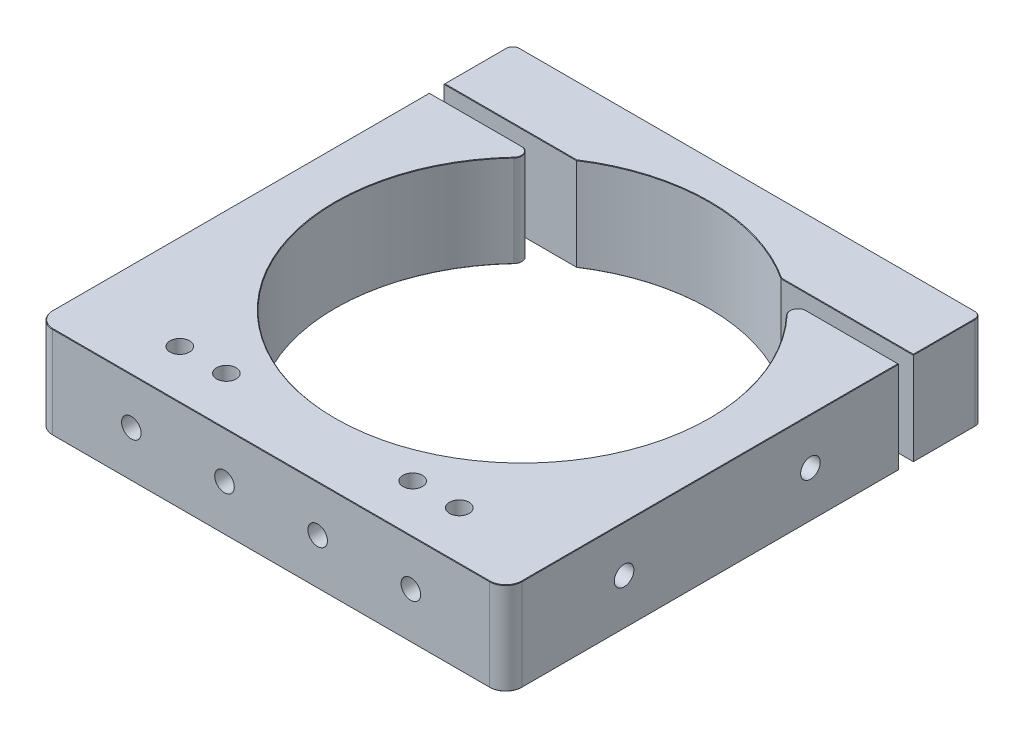
from build123d import *

# Parameters (mm, degrees)
BOSS_EXTRUDE1_DEPTH            = 9.9
BOSS_EXTRUDE2_DEPTH            = 10
FILLET1_R                      = 3.5
FILLET2_R                      = 1.75
M5X0_8_TAPPED_HOLE1_AT_2_COUNT = 2
M5X0_8_TAPPED_HOLE1_AT_2_PITCH = 20
M5X0_8_TAPPED_HOLE1_AT_3_COUNT = 2
M5X0_8_TAPPED_HOLE1_AT_3_PITCH = 40
M5X0_8_TAPPED_HOLE1_AT_4_COUNT = 2
M5X0_8_TAPPED_HOLE1_AT_4_PITCH = 60
M5X0_8_TAPPED_HOLE2_AT_2_COUNT = 2
M5X0_8_TAPPED_HOLE2_AT_2_PITCH = 40
CUT_EXTRUDE1_DEPTH             = 1
SKETCH9_R                      = 3.05
CUT_EXTRUDE2_DEPTH             = 14.75
M5X0_8_TAPPED_HOLE3_AT_2_COUNT = 2
M5X0_8_TAPPED_HOLE3_AT_2_PITCH = 83.2
SKETCH20_R                     = 5.09
CUT_EXTRUDE4_DEPTH             = 1.5
CHAMFER1_SIZE                  = 0.1
FILLET3_R                      = 1.5
CHAMFER2_SIZE                  = 0.1
SKETCH16_W                     = 2.1
SKETCH16_H                     = 19.9
M5X0_8_TAPPED_HOLE4_AT_2_COUNT = 2
M5X0_8_TAPPED_HOLE4_AT_2_PITCH = 10
M5X0_8_TAPPED_HOLE4_AT_3_COUNT = 2
M5X0_8_TAPPED_HOLE4_AT_3_PITCH = 50
M5X0_8_TAPPED_HOLE4_AT_4_COUNT = 2
M5X0_8_TAPPED_HOLE4_AT_4_PITCH = 60
CUT_EXTRUDE3_DEPTH             = 0.001


with BuildPart() as part:
    # Sketch1 → Boss-Extrude1 (new, symmetric)
    with BuildSketch(Plane(origin=(0, 0, 0), x_dir=(1, 0, 0), z_dir=(0, 1, 0))):
        with BuildLine():
            ThreePointArc((-26.1597974, 30.425), (0, -40.125), (26.1597974, 30.425))
            Line((26.1597974, 30.425), (50.375, 30.425))
            Line((50.375, 30.425), (50.375, -53.925))
            Line((50.375, -53.925), (-50.375, -53.925))
            Line((-50.375, -53.925), (-50.375, 30.425))
            Line((-50.375, 30.425), (-26.1597974, 30.425))
        make_face()
    extrude(amount=BOSS_EXTRUDE1_DEPTH, both=True)

    # Fillet1
    fillet1_edges = [part.edges().sort_by_distance(p)[0] for p in [
        (50.375, 0, 53.925),
        (-50.375, 0, 53.925),
    ]]
    fillet(fillet1_edges, radius=FILLET1_R)

    # Fillet2
    fillet2_edges = [part.edges().sort_by_distance(p)[0] for p in [
        (26.1597974, 0, -30.425),
        (-26.1597974, 0, -30.425),
    ]]
    fillet(fillet2_edges, radius=FILLET2_R)

    # Sketch4 → M5x0.8 Tapped Hole1 (revolve, cut)
    with BuildSketch(Plane(origin=(-30, 0, 53.925), x_dir=(0, -1, 0), z_dir=(1, 0, 0))):
        Polygon((0, 0), (0, 11.6618073), (2.1, 10.4), (2.1, 0), align=None)
    m5x0_8_tapped_hole1 = revolve(axis=Axis((-30, 0, 60.275), (0, 0, -1)), mode=Mode.SUBTRACT)

    # M5x0.8 Tapped Hole1 at 2: M5x0.8 Tapped Hole1 ×2
    with Locations(*[(i * M5X0_8_TAPPED_HOLE1_AT_2_PITCH, 0, 0) for i in range(1, M5X0_8_TAPPED_HOLE1_AT_2_COUNT)]):
        add(m5x0_8_tapped_hole1, mode=Mode.SUBTRACT)

    # M5x0.8 Tapped Hole1 at 3: M5x0.8 Tapped Hole1 ×2
    with Locations(*[(i * M5X0_8_TAPPED_HOLE1_AT_3_PITCH, 0, 0) for i in range(1, M5X0_8_TAPPED_HOLE1_AT_3_COUNT)]):
        add(m5x0_8_tapped_hole1, mode=Mode.SUBTRACT)

    # M5x0.8 Tapped Hole1 at 4: M5x0.8 Tapped Hole1 ×2
    with Locations(*[(i * M5X0_8_TAPPED_HOLE1_AT_4_PITCH, 0, 0) for i in range(1, M5X0_8_TAPPED_HOLE1_AT_4_COUNT)]):
        add(m5x0_8_tapped_hole1, mode=Mode.SUBTRACT)

    # Sketch7 → M5x0.8 Tapped Hole2 (revolve, cut)
    with BuildSketch(Plane(origin=(50.375, 0, 28.525), x_dir=(0, 0, -1), z_dir=(0, 1, 0))):
        Polygon((0, 0), (0, 11.6618073), (2.1, 10.4), (2.1, 0), align=None)
    m5x0_8_tapped_hole2 = revolve(axis=Axis((56.725, 0, 28.525), (-1, 0, 0)), mode=Mode.SUBTRACT)

    # M5x0.8 Tapped Hole2 at 2: M5x0.8 Tapped Hole2 ×2
    with Locations(*[(0, 0, -i * M5X0_8_TAPPED_HOLE2_AT_2_PITCH) for i in range(1, M5X0_8_TAPPED_HOLE2_AT_2_COUNT)]):
        add(m5x0_8_tapped_hole2, mode=Mode.SUBTRACT)

    # Mirror1: M5x0.8 Tapped Hole2 across plane
    add(m5x0_8_tapped_hole2.mirror(Plane(origin=(0, 0, 0), x_dir=(0, 0, 1), z_dir=(1, 0, 0))), mode=Mode.SUBTRACT)

    # Mirror1 copy 1 sketch → Mirror1 copy 1 (revolve, cut)
    with BuildSketch(Plane(origin=(-50.375, 0, -11.475), x_dir=(0, 0, -1), z_dir=(0, 1, 0))):
        Polygon((0, 0), (0, -11.6618073), (2.1, -10.4), (2.1, 0), align=None)
    revolve(axis=Axis((-56.725, 0, -11.475), (-1, 0, 0)), mode=Mode.SUBTRACT)

    # Sketch13 → M5x0.8 Tapped Hole3 (revolve, cut)
    with BuildSketch(Plane(origin=(41.6, 0, -30.425), x_dir=(0, 1, 0), z_dir=(1, 0, 0))):
        Polygon((0, 0), (0, 22.6618073), (2.1, 21.4), (2.1, 0), align=None)
    m5x0_8_tapped_hole3 = revolve(axis=Axis((41.6, 0, -36.775), (0, 0, 1)), mode=Mode.SUBTRACT)

    # M5x0.8 Tapped Hole3 at 2: M5x0.8 Tapped Hole3 ×2
    with Locations(*[(-i * M5X0_8_TAPPED_HOLE3_AT_2_PITCH, 0, 0) for i in range(1, M5X0_8_TAPPED_HOLE3_AT_2_COUNT)]):
        add(m5x0_8_tapped_hole3, mode=Mode.SUBTRACT)

    # Chamfer1
    chamfer1_edges = [part.edges().sort_by_distance(p)[0] for p in [
        (50.375, 0, -30.425),
        (-50.375, 0, -30.425),
        (0, -9.9, 53.925),
        (0, 9.9, 53.925),
        (50.375, -9.9, 10),
        (-50.375, -9.9, 10),
        (49.349873734, -9.9, 52.899873734),
        (-49.349873734, -9.9, 52.899873734),
        (-50.375, 9.9, 10),
        (50.375, 9.9, 10),
        (49.349873734, 9.9, 52.899873734),
        (40.445776443, 9.9, -30.425),
        (-49.349873734, 9.9, 52.899873734),
        (0, -9.9, 40.125),
        (0, 9.9, 40.125),
        (-28.910373122, -9.9, -29.36975648),
        (28.910373122, -9.9, -29.36975648),
        (-28.910373122, 9.9, -29.36975648),
        (28.910373122, 9.9, -29.36975648),
        (40.445776443, -9.9, -30.425),
        (-40.445776443, 9.9, -30.425),
        (-40.445776443, -9.9, -30.425),
    ]]
    chamfer(chamfer1_edges, length=CHAMFER1_SIZE)

    # Sketch16 → M5x0.8 Tapped Hole4 (revolve, cut)
    with BuildSketch(Plane(origin=(-30, 9.9, 43.525), x_dir=(0, 0, 1), z_dir=(1, 0, 0))):
        with Locations((1.05, 9.95)):
            Rectangle(SKETCH16_W, SKETCH16_H)
    m5x0_8_tapped_hole4 = revolve(axis=Axis((-30, 16.25, 43.525), (0, -1, 0)), mode=Mode.SUBTRACT)

    # M5x0.8 Tapped Hole4 at 2: M5x0.8 Tapped Hole4 ×2
    with Locations(*[(i * M5X0_8_TAPPED_HOLE4_AT_2_PITCH, 0, 0) for i in range(1, M5X0_8_TAPPED_HOLE4_AT_2_COUNT)]):
        add(m5x0_8_tapped_hole4, mode=Mode.SUBTRACT)

    # M5x0.8 Tapped Hole4 at 3: M5x0.8 Tapped Hole4 ×2
    with Locations(*[(i * M5X0_8_TAPPED_HOLE4_AT_3_PITCH, 0, 0) for i in range(1, M5X0_8_TAPPED_HOLE4_AT_3_COUNT)]):
        add(m5x0_8_tapped_hole4, mode=Mode.SUBTRACT)

    # M5x0.8 Tapped Hole4 at 4: M5x0.8 Tapped Hole4 ×2
    with Locations(*[(i * M5X0_8_TAPPED_HOLE4_AT_4_PITCH, 0, 0) for i in range(1, M5X0_8_TAPPED_HOLE4_AT_4_COUNT)]):
        add(m5x0_8_tapped_hole4, mode=Mode.SUBTRACT)


with BuildPart() as body_2:
    # Sketch1<3> → Boss-Extrude2 (new, symmetric)
    with BuildSketch(Plane(origin=(0, 0, 0), x_dir=(1, 0, 0), z_dir=(0, 1, 0))):
        with BuildLine():
            ThreePointArc((21.97123119, 33.575), (0, 40.125), (-21.97123119, 33.575))
            Line((-21.97123119, 33.575), (-50.375, 33.575))
            Line((-50.375, 33.575), (-50.375, 48.325))
            Line((-50.375, 48.325), (50.375, 48.325))
            Line((50.375, 48.325), (50.375, 33.575))
            Line((50.375, 33.575), (21.97123119, 33.575))
        make_face()
    extrude(amount=BOSS_EXTRUDE2_DEPTH, both=True)

    # Sketch8 → Cut-Extrude1 (cut)
    with BuildSketch(Plane(origin=(0, 0, -48.325), x_dir=(-1, 0, 0), z_dir=(0, 0, -1))):
        with BuildLine():
            Line((-25, -6.5), (25, -6.5))
            ThreePointArc((25, -6.5), (26.767766953, -5.767766953), (27.5, -4))
            Line((27.5, -4), (27.5, 4))
            ThreePointArc((27.5, 4), (26.767766953, 5.767766953), (25, 6.5))
            Line((25, 6.5), (-25, 6.5))
            ThreePointArc((-25, 6.5), (-26.767766953, 5.767766953), (-27.5, 4))
            Line((-27.5, 4), (-27.5, -4))
            ThreePointArc((-27.5, -4), (-26.767766953, -5.767766953), (-25, -6.5))
        make_face()
    extrude(amount=-CUT_EXTRUDE1_DEPTH, mode=Mode.SUBTRACT)

    # Sketch9 → Cut-Extrude2 (cut)
    with BuildSketch(Plane(origin=(0, 0, -48.325), x_dir=(-1, 0, 0), z_dir=(0, 0, -1))):
        with Locations((-41.6, 0)):
            Circle(SKETCH9_R)
        with Locations((41.6, 0)):
            Circle(SKETCH9_R)
    extrude(amount=-CUT_EXTRUDE2_DEPTH, mode=Mode.SUBTRACT)

    # Sketch20 → Cut-Extrude4 (cut)
    with BuildSketch(Plane(origin=(0, 0, -48.325), x_dir=(-1, 0, 0), z_dir=(0, 0, -1))):
        with Locations((-41.6, 0)):
            Circle(SKETCH20_R)
        with Locations((41.6, 0)):
            Circle(SKETCH20_R)
    extrude(amount=-CUT_EXTRUDE4_DEPTH, mode=Mode.SUBTRACT)

    # Fillet3
    fillet3_edges = [body_2.edges().sort_by_distance(p)[0] for p in [
        (-50.375, 0, -48.325),
        (50.375, 0, -48.325),
    ]]
    fillet(fillet3_edges, radius=FILLET3_R)

    # Chamfer2
    chamfer2_edges = [body_2.edges().sort_by_distance(p)[0] for p in [
        (50.375, 10, -40.2),
        (-50.375, 10, -40.2),
        (-36.173115595, 10, -33.575),
        (0, 10, -40.125),
        (0, -10, -48.325),
        (0, 10, -48.325),
        (-36.173115595, -10, -33.575),
        (-49.935660172, -10, -47.885660172),
        (49.935660172, -10, -47.885660172),
        (-49.935660172, 10, -47.885660172),
        (49.935660172, 10, -47.885660172),
        (-50.375, -10, -40.2),
        (50.375, -10, -40.2),
        (36.173115595, 10, -33.575),
        (36.173115595, -10, -33.575),
        (0, -10, -40.125),
    ]]
    chamfer(chamfer2_edges, length=CHAMFER2_SIZE)

    # Sketch17 → Cut-Extrude3 (cut)
    # profile 1 of 5: a face of its own
    with BuildSketch(Plane(origin=(0, 0, -47.325), x_dir=(-1, 0, 0), z_dir=(0, 0, -1))):
        with BuildLine():
            add(Edge.make_bspline(
                [(-14.995192308, 2.926282051), (-14.905475878, 2.83030885), (-14.726669214, 2.639032313), (-14.496639815, 2.32089689), (-14.297503803, 1.982729094), (-14.135159407, 1.622747777), (-14.003497398, 1.245727587), (-13.913967781, 0.850519345), (-13.854928948, 0.44035452), (-13.849107978, 0.16100179), (-13.846153846, 0.019230769)],
                knots=[0, 0, 0, 0, 0.981961129, 1.957068436, 2.929584897, 3.913130261, 4.906417375, 5.911594059, 6.94013765, 8, 8, 8, 8], degree=3))
            add(Edge.make_bspline(
                [(-13.846153846, 0.019230769), (-13.849701403, -0.125203306), (-13.856694317, -0.409910481), (-13.91644456, -0.827862903), (-14.010484082, -1.229555818), (-14.143456219, -1.614727204), (-14.318487649, -1.981657343), (-14.529595457, -2.332476366), (-14.777250204, -2.668003448), (-15.063006371, -2.980246153), (-15.374031761, -3.266728052), (-15.705102829, -3.519229111), (-16.055293689, -3.729471708), (-16.420362325, -3.903986689), (-16.802799213, -4.039467976), (-17.202378844, -4.13519033), (-17.61894679, -4.194492664), (-17.902579745, -4.20154856), (-18.046474359, -4.205128205)],
                knots=[0, 0, 0, 0, 1.044514704, 2.058938173, 3.047908479, 4.025699844, 5.000722405, 5.983655766, 6.983874203, 8.012582426, 9.041043788, 10.039707976, 11.019330699, 11.990861941, 12.962639136, 13.948750856, 14.959346228, 16, 16, 16, 16], degree=3))
            add(Edge.make_bspline(
                [(-18.046474359, -4.205128205), (-18.156620339, -4.203173692), (-18.374818327, -4.199301823), (-18.697698307, -4.162272874), (-19.013472714, -4.105420374), (-19.321666832, -4.022562781), (-19.623495221, -3.919533577), (-19.916075949, -3.789255478), (-20.203212481, -3.639579441), (-20.385511917, -3.521275894), (-20.477564103, -3.461538462)],
                knots=[0, 0, 0, 0, 1.023812046, 2.028160523, 3.017996657, 4.004749707, 4.99280207, 5.980292441, 6.980147716, 8, 8, 8, 8], degree=3))
            Line((-20.477564103, -3.461538462), (-21.314102564, -4.434294872))
            Line((-21.314102564, -4.434294872), (-21.897435897, -4.051282051))
            Line((-21.897435897, -4.051282051), (-21.012820513, -3.022435897))
            add(Edge.make_bspline(
                [(-21.012820513, -3.022435897), (-21.112344754, -2.92083419), (-21.308477025, -2.720607861), (-21.559885901, -2.388160837), (-21.776525865, -2.04204346), (-21.952374489, -1.67650305), (-22.089347009, -1.29412555), (-22.184458351, -0.893093976), (-22.246310585, -0.475749842), (-22.253011645, -0.190928604), (-22.256410256, -0.046474359)],
                knots=[0, 0, 0, 0, 1.028005719, 2.025889293, 3.00822111, 3.977890377, 4.954557743, 5.94062254, 6.955534997, 8, 8, 8, 8], degree=3))
            add(Edge.make_bspline(
                [(-22.256410256, -0.046474359), (-22.255183627, 0.049219464), (-22.252745787, 0.23940435), (-22.223628026, 0.521321807), (-22.181152612, 0.798192215), (-22.11992219, 1.069607392), (-22.041224021, 1.336188956), (-21.945172487, 1.597572502), (-21.830739484, 1.853302547), (-21.699678384, 2.101909435), (-21.554660713, 2.34243175), (-21.394128198, 2.569246815), (-21.222283171, 2.784297435), (-21.035731847, 2.983852514), (-20.838797551, 3.172409356), (-20.628189334, 3.345802827), (-20.404486628, 3.504754286), (-20.169273508, 3.649881762), (-19.925542024, 3.781844973), (-19.672865424, 3.892995511), (-19.415573463, 3.990755245), (-19.151769946, 4.068218945), (-18.882165332, 4.130319214), (-18.606761242, 4.172145145), (-18.325421505, 4.201556069), (-18.13576148, 4.203930255), (-18.040064103, 4.205128205)],
                knots=[0, 0, 0, 0, 1.032463199, 2.05194952, 3.055794488, 4.054526573, 5.052459485, 6.053917263, 7.057911242, 8.074049756, 9.085614184, 10.086988971, 11.071186015, 12.05441994, 13.033197727, 14.012094382, 14.996021172, 15.992837502, 16.993697593, 17.984811524, 18.970055101, 19.962459534, 20.949944353, 21.953789321, 22.967536801, 24, 24, 24, 24], degree=3))
            add(Edge.make_bspline(
                [(-18.040064103, 4.205128205), (-17.92458896, 4.202551367), (-17.696252356, 4.197456016), (-17.357389854, 4.160185755), (-17.027499922, 4.095820821), (-16.705270232, 4.006729619), (-16.390125394, 3.895902395), (-16.085181903, 3.753781895), (-15.785553422, 3.592303116), (-15.596709179, 3.463770603), (-15.501602564, 3.399038462)],
                knots=[0, 0, 0, 0, 1.023710526, 2.024250235, 3.018120468, 4.000515576, 4.986227305, 5.97594737, 6.980637206, 8, 8, 8, 8], degree=3))
            Line((-15.501602564, 3.399038462), (-14.788461538, 4.229166667))
            Line((-14.788461538, 4.229166667), (-14.205128205, 3.846153846))
            Line((-14.205128205, 3.846153846), (-14.995192308, 2.926282051))
        make_face()
        with BuildLine():
            Line((-20.516025641, -2.440705128), (-16.016025641, 2.798076923))
            add(Edge.make_bspline(
                [(-16.016025641, 2.798076923), (-16.087337756, 2.845357658), (-16.229593634, 2.939674907), (-16.45705753, 3.056988223), (-16.692284361, 3.159280046), (-16.937253549, 3.242253186), (-17.191239582, 3.306632111), (-17.454410109, 3.351048791), (-17.72642985, 3.378902796), (-17.91125733, 3.382695639), (-18.004807692, 3.384615385)],
                knots=[0, 0, 0, 0, 0.974350033, 1.943667194, 2.911607211, 3.89526798, 4.887386831, 5.894131756, 6.934115557, 8, 8, 8, 8], degree=3))
            add(Edge.make_bspline(
                [(-18.004807692, 3.384615385), (-18.081792618, 3.38366781), (-18.23556374, 3.381775108), (-18.463965727, 3.357706656), (-18.689912814, 3.322923274), (-18.912179698, 3.273431408), (-19.131468092, 3.208602125), (-19.347800628, 3.130206276), (-19.56132401, 3.036978802), (-19.769817618, 2.930076029), (-19.971810462, 2.811718192), (-20.163825479, 2.68265201), (-20.343175255, 2.542230497), (-20.513682023, 2.394911901), (-20.669227625, 2.23402037), (-20.816347191, 2.066158697), (-20.949543038, 1.886408166), (-21.072629847, 1.699159027), (-21.181283888, 1.502610076), (-21.278579322, 1.301103325), (-21.357614347, 1.092576526), (-21.424621207, 0.879303601), (-21.475140651, 0.660077063), (-21.512755773, 0.434850354), (-21.533030039, 0.203898044), (-21.536640725, 0.048111859), (-21.538461538, -0.030448718)],
                knots=[0, 0, 0, 0, 1.013512141, 2.024408004, 3.021474407, 4.023443592, 5.020807819, 6.031238402, 7.052074388, 8.087283119, 9.115342633, 10.133945689, 11.131731682, 12.113917714, 13.098997308, 14.076561144, 15.05169146, 16.043007304, 17.025671991, 18.007530388, 18.98747119, 19.959932871, 20.949749597, 21.947932383, 22.965173865, 24, 24, 24, 24], degree=3))
            add(Edge.make_bspline(
                [(-21.538461538, -0.030448718), (-21.535468446, -0.143338726), (-21.529553714, -0.366423776), (-21.479844721, -0.695056816), (-21.399777874, -1.013031871), (-21.286270477, -1.320165788), (-21.143582623, -1.61901108), (-20.96550084, -1.905368934), (-20.759047835, -2.184155761), (-20.598012389, -2.35415481), (-20.516025641, -2.440705128)],
                knots=[0, 0, 0, 0, 1.007398495, 1.990747874, 2.960038447, 3.930173371, 4.909234549, 5.911199966, 6.936545179, 8, 8, 8, 8], degree=3))
        make_face(mode=Mode.SUBTRACT)
        with BuildLine():
            Line((-15.504807692, 2.330128205), (-19.975961538, -2.876602564))
            add(Edge.make_bspline(
                [(-19.975961538, -2.876602564), (-19.908621056, -2.917006593), (-19.774282259, -2.99760935), (-19.563485891, -3.103013696), (-19.343273585, -3.187994844), (-19.117000123, -3.261841667), (-18.88177811, -3.315100691), (-18.640009382, -3.355488403), (-18.389935232, -3.380204112), (-18.220675419, -3.383128488), (-18.134615385, -3.384615385)],
                knots=[0, 0, 0, 0, 0.973214489, 1.9414839, 2.916498556, 3.896468988, 4.889018759, 5.902417826, 6.933485811, 8, 8, 8, 8], degree=3))
            add(Edge.make_bspline(
                [(-18.134615385, -3.384615385), (-18.053905579, -3.383531391), (-17.893812737, -3.381381225), (-17.655664699, -3.359621778), (-17.422184148, -3.325072926), (-17.193411224, -3.274416306), (-16.969625546, -3.212361317), (-16.74966655, -3.137047755), (-16.535721061, -3.044933874), (-16.325945939, -2.941642199), (-16.125066537, -2.824810412), (-15.933912192, -2.698130981), (-15.753534996, -2.56171583), (-15.585334466, -2.414459047), (-15.429031034, -2.255951203), (-15.283153846, -2.088471393), (-15.150039222, -1.909581363), (-15.028256507, -1.722391379), (-14.91920332, -1.527125052), (-14.824835266, -1.325062832), (-14.744100869, -1.117459799), (-14.678583643, -0.904219119), (-14.627304186, -0.685765233), (-14.589963478, -0.462613855), (-14.569452187, -0.23382526), (-14.565900093, -0.079631819), (-14.564102564, -0.001602564)],
                knots=[0, 0, 0, 0, 1.059116737, 2.100822918, 3.13606712, 4.155158008, 5.17415241, 6.183061831, 7.204080535, 8.229447547, 9.250466251, 10.2519662, 11.237807278, 12.216641935, 13.183449152, 14.157677384, 15.129480399, 16.107712171, 17.087023848, 18.062538024, 19.03259417, 20.008435864, 20.988048699, 21.975907368, 22.975712335, 24, 24, 24, 24], degree=3))
            add(Edge.make_bspline(
                [(-14.564102564, -0.001602564), (-14.566668647, 0.105936891), (-14.571759855, 0.3192993), (-14.618856333, 0.634713237), (-14.691657375, 0.941364129), (-14.795651092, 1.238397586), (-14.927376898, 1.526972619), (-15.090513799, 1.805778134), (-15.281023018, 2.077394189), (-15.429393776, 2.244958557), (-15.504807692, 2.330128205)],
                knots=[0, 0, 0, 0, 1.001482496, 1.986979746, 2.964867839, 3.934550693, 4.914564687, 5.915985334, 6.940736631, 8, 8, 8, 8], degree=3))
        make_face(mode=Mode.SUBTRACT)
    # profile 2 of 5: a face of its own
    with BuildSketch(Plane(origin=(0, 0, -47.325), x_dir=(-1, 0, 0), z_dir=(0, 0, -1))):
        with BuildLine():
            add(Edge.make_bspline(
                [(-5.956730769, 0.456730769), (-5.891248376, 0.42258687), (-5.763535839, 0.355994863), (-5.581645078, 0.248770114), (-5.415416504, 0.135762195), (-5.260238077, 0.022308802), (-5.118836132, -0.095934973), (-4.99279176, -0.21943933), (-4.878991486, -0.345121491), (-4.779730265, -0.475109697), (-4.69242321, -0.609058609), (-4.616966901, -0.747319805), (-4.552470437, -0.889590282), (-4.501355149, -1.037423036), (-4.459248196, -1.188646491), (-4.430275385, -1.345213307), (-4.414693858, -1.5060918), (-4.411747999, -1.614819347), (-4.41025641, -1.669871795)],
                knots=[0, 0, 0, 0, 1.272397273, 2.481599622, 3.635517121, 4.734568067, 5.792894095, 6.808321871, 7.773003508, 8.711915296, 9.623354172, 10.525449501, 11.423591555, 12.311487226, 13.218079475, 14.126165749, 15.051214107, 16, 16, 16, 16], degree=3))
            add(Edge.make_bspline(
                [(-4.41025641, -1.669871795), (-4.412019657, -1.746895184), (-4.415509785, -1.899353371), (-4.445909748, -2.124373054), (-4.491425127, -2.34291427), (-4.557892584, -2.554929106), (-4.64409462, -2.759247674), (-4.750327388, -2.95604487), (-4.870581571, -3.148546148), (-4.967158118, -3.266990495), (-5.016025641, -3.326923077)],
                knots=[0, 0, 0, 0, 1.025265484, 2.029385089, 3.018602448, 3.995076438, 4.983346944, 5.966715145, 6.97116228, 8, 8, 8, 8], degree=3))
            add(Edge.make_bspline(
                [(-5.016025641, -3.326923077), (-5.079651868, -3.396851704), (-5.206118075, -3.53584483), (-5.422764767, -3.716303824), (-5.660529073, -3.867959582), (-5.918490976, -3.991552484), (-6.195960922, -4.087748733), (-6.49287979, -4.156874488), (-6.809826425, -4.196468612), (-7.027667502, -4.202192017), (-7.139423077, -4.205128205)],
                knots=[0, 0, 0, 0, 0.954267603, 1.896743057, 2.838368354, 3.796610408, 4.779680527, 5.799409237, 6.871065594, 8, 8, 8, 8], degree=3))
            add(Edge.make_bspline(
                [(-7.139423077, -4.205128205), (-7.246882251, -4.20249397), (-7.455986889, -4.197368015), (-7.760347752, -4.162637886), (-8.044057625, -4.101774191), (-8.308766124, -4.018472227), (-8.552877423, -3.910105991), (-8.77569594, -3.775229628), (-8.980436448, -3.619272046), (-9.160885531, -3.437754153), (-9.321087688, -3.243336159), (-9.461814667, -3.042761051), (-9.578783989, -2.836010519), (-9.67781735, -2.626167394), (-9.753629973, -2.41029047), (-9.806137882, -2.18949044), (-9.839484886, -1.964152971), (-9.843921766, -1.812080621), (-9.846153846, -1.735576923)],
                knots=[0, 0, 0, 0, 1.256902934, 2.445805442, 3.576955095, 4.645999104, 5.686449165, 6.692658513, 7.68621702, 8.689161843, 9.678783111, 10.630372946, 11.551080876, 12.453998257, 13.34127905, 14.221779781, 15.105423033, 16, 16, 16, 16], degree=3))
            add(Edge.make_bspline(
                [(-9.846153846, -1.735576923), (-9.844832975, -1.679441627), (-9.842222468, -1.568498468), (-9.824154244, -1.404591432), (-9.795106332, -1.24505741), (-9.755656145, -1.089307139), (-9.702190942, -0.938474516), (-9.637637494, -0.791844862), (-9.56236446, -0.649252636), (-9.475321797, -0.50991805), (-9.374060028, -0.375793451), (-9.259400257, -0.244602606), (-9.129050843, -0.118381195), (-8.984461908, 0.004412919), (-8.827285818, 0.125958002), (-8.653440034, 0.239685381), (-8.467533136, 0.353646444), (-8.335406495, 0.421779759), (-8.267628205, 0.456730769)],
                knots=[0, 0, 0, 0, 0.941657376, 1.861047343, 2.762797495, 3.66048619, 4.553285746, 5.444104102, 6.34607688, 7.256116206, 8.197091036, 9.162375105, 10.176350973, 11.237807142, 12.343728897, 13.50695164, 14.721116704, 16, 16, 16, 16], degree=3))
            add(Edge.make_bspline(
                [(-8.267628205, 0.456730769), (-8.36040849, 0.507324526), (-8.540057091, 0.6052882), (-8.777930099, 0.7852809), (-8.982251524, 0.980224477), (-9.147405165, 1.194235436), (-9.277398829, 1.420628292), (-9.366584211, 1.657986583), (-9.426919031, 1.901909128), (-9.432895779, 2.068551863), (-9.435897436, 2.15224359)],
                knots=[0, 0, 0, 0, 1.166880483, 2.259407225, 3.286803203, 4.280235371, 5.237608625, 6.161067461, 7.076446754, 8, 8, 8, 8], degree=3))
            add(Edge.make_bspline(
                [(-9.435897436, 2.15224359), (-9.432159324, 2.237495152), (-9.424645066, 2.408865659), (-9.363883191, 2.663965369), (-9.264865896, 2.914517518), (-9.130189331, 3.159307719), (-8.962447123, 3.390051067), (-8.761197875, 3.597001801), (-8.531247482, 3.778285189), (-8.273743786, 3.930459299), (-7.99663239, 4.054307662), (-7.704253593, 4.139744057), (-7.401701609, 4.195598038), (-7.195763964, 4.20192182), (-7.091346154, 4.205128205)],
                knots=[0, 0, 0, 0, 0.888701115, 1.786444228, 2.72001202, 3.692817113, 4.693886446, 5.687152267, 6.695133018, 7.739871481, 8.800368666, 9.853104506, 10.91144658, 12, 12, 12, 12], degree=3))
            add(Edge.make_bspline(
                [(-7.091346154, 4.205128205), (-6.989623148, 4.201822278), (-6.78903697, 4.195303366), (-6.494192106, 4.140933359), (-6.212078101, 4.050123029), (-5.943667818, 3.926929375), (-5.693766406, 3.775187796), (-5.472961128, 3.59141437), (-5.277915226, 3.38537654), (-5.116579468, 3.154703161), (-4.983635721, 2.910853575), (-4.891062233, 2.655716384), (-4.831743435, 2.39480425), (-4.82426146, 2.218260241), (-4.820512821, 2.129807692)],
                knots=[0, 0, 0, 0, 1.072916533, 2.115669174, 3.151510826, 4.193348718, 5.225979165, 6.227137561, 7.216255879, 8.211077061, 9.189680878, 10.138522389, 11.067357538, 12, 12, 12, 12], degree=3))
            add(Edge.make_bspline(
                [(-4.820512821, 2.129807692), (-4.823791816, 2.043003889), (-4.830231577, 1.872526154), (-4.884402868, 1.624008392), (-4.975633299, 1.391272304), (-5.100191386, 1.171676984), (-5.262535357, 0.96920499), (-5.460498176, 0.78128163), (-5.692501554, 0.606363165), (-5.866812151, 0.507651475), (-5.956730769, 0.456730769)],
                knots=[0, 0, 0, 0, 0.975232327, 1.915300861, 2.843280834, 3.77672583, 4.742871857, 5.749627742, 6.839139064, 8, 8, 8, 8], degree=3))
        make_face()
        with BuildLine():
            add(Edge.make_bspline(
                [(-7.131410256, 3.384615385), (-7.187526384, 3.383126378), (-7.297314067, 3.380213229), (-7.458293886, 3.364993487), (-7.611373583, 3.335386135), (-7.758152556, 3.295983365), (-7.896618413, 3.242753678), (-8.02865168, 3.180136514), (-8.152005257, 3.104008364), (-8.268168235, 3.018611341), (-8.372741434, 2.924684698), (-8.465551838, 2.826824769), (-8.54264467, 2.723109588), (-8.608110063, 2.616119051), (-8.655610675, 2.502677734), (-8.691186226, 2.386263616), (-8.715235121, 2.265405596), (-8.717037156, 2.182807857), (-8.717948718, 2.141025641)],
                knots=[0, 0, 0, 0, 1.203892937, 2.355340988, 3.463153438, 4.544400666, 5.610487187, 6.640501085, 7.674077295, 8.714426146, 9.728707835, 10.68524104, 11.601827946, 12.495867327, 13.368432065, 14.231010473, 15.105153427, 16, 16, 16, 16], degree=3))
            add(Edge.make_bspline(
                [(-8.717948718, 2.141025641), (-8.716377594, 2.099241619), (-8.713272826, 2.01667039), (-8.689261105, 1.894736982), (-8.653474008, 1.774916098), (-8.597129639, 1.660056872), (-8.529549392, 1.546174909), (-8.446140304, 1.436116426), (-8.346736811, 1.329498404), (-8.234674091, 1.227227681), (-8.112590576, 1.13145908), (-7.98325562, 1.048320379), (-7.848292439, 0.978756698), (-7.70908771, 0.920860916), (-7.564222687, 0.875855345), (-7.414585033, 0.84392701), (-7.2601496, 0.824082446), (-7.155508272, 0.821712111), (-7.102564103, 0.820512821)],
                knots=[0, 0, 0, 0, 0.873023192, 1.725219244, 2.590779336, 3.480155217, 4.391973325, 5.357036234, 6.360879153, 7.436073238, 8.526419356, 9.601555421, 10.645666583, 11.697338044, 12.750135903, 13.812665442, 14.89329948, 16, 16, 16, 16], degree=3))
            add(Edge.make_bspline(
                [(-7.102564103, 0.820512821), (-7.034563865, 0.822507945), (-6.899235025, 0.82647849), (-6.69973941, 0.863395458), (-6.505767651, 0.921466127), (-6.319393013, 1.000917479), (-6.145439675, 1.100638301), (-5.990376662, 1.220028057), (-5.855526621, 1.356329993), (-5.742290941, 1.507422189), (-5.654497006, 1.66822582), (-5.586150017, 1.829597917), (-5.546238667, 1.99326016), (-5.5410328, 2.102898934), (-5.538461538, 2.157051282)],
                knots=[0, 0, 0, 0, 1.076279235, 2.141928126, 3.20205304, 4.278698113, 5.344010996, 6.36967002, 7.368914609, 8.37248503, 9.349703398, 10.264243087, 11.142681841, 12, 12, 12, 12], degree=3))
            add(Edge.make_bspline(
                [(-5.538461538, 2.157051282), (-5.539677304, 2.195058221), (-5.542090425, 2.270496548), (-5.561976268, 2.381898526), (-5.594835314, 2.490766145), (-5.639322355, 2.597998764), (-5.697859028, 2.702091866), (-5.767262885, 2.804681782), (-5.851570317, 2.90346067), (-5.946190736, 3.000730495), (-6.053494528, 3.090751121), (-6.173274899, 3.169916173), (-6.304917757, 3.237144416), (-6.448426214, 3.291747284), (-6.603271754, 3.332758369), (-6.768741182, 3.363470021), (-6.946214203, 3.38077999), (-7.068339349, 3.383309192), (-7.131410256, 3.384615385)],
                knots=[0, 0, 0, 0, 0.814439003, 1.616544685, 2.417341072, 3.248991801, 4.09997495, 4.973547432, 5.9003056, 6.880240646, 7.880314356, 8.896779544, 9.951930927, 11.043077905, 12.18215768, 13.381699519, 14.647792085, 16, 16, 16, 16], degree=3))
        make_face(mode=Mode.SUBTRACT)
        with BuildLine():
            add(Edge.make_bspline(
                [(-7.084935897, 0), (-7.15608055, -0.001265466), (-7.295648999, -0.003748001), (-7.500121978, -0.031381145), (-7.696357785, -0.069848329), (-7.883694782, -0.128204532), (-8.062053861, -0.204082224), (-8.232400564, -0.295361172), (-8.393431717, -0.403259328), (-8.542923663, -0.526405878), (-8.67943413, -0.659113201), (-8.799201673, -0.799598081), (-8.900910291, -0.945249585), (-8.982814865, -1.097917538), (-9.050041681, -1.25436922), (-9.094187686, -1.418500866), (-9.122488741, -1.587157125), (-9.126289042, -1.701808778), (-9.128205128, -1.759615385)],
                knots=[0, 0, 0, 0, 1.140299081, 2.23698856, 3.303958914, 4.344563908, 5.37730929, 6.408454204, 7.439741482, 8.480804886, 9.510774543, 10.48932336, 11.43758569, 12.353841022, 13.263987381, 14.161954604, 15.073269652, 16, 16, 16, 16], degree=3))
            add(Edge.make_bspline(
                [(-9.128205128, -1.759615385), (-9.125089108, -1.831457456), (-9.118906997, -1.973990446), (-9.069863251, -2.184648895), (-8.991153456, -2.388582735), (-8.881381534, -2.584130055), (-8.745455654, -2.766873155), (-8.578309441, -2.926161785), (-8.390330383, -3.067696593), (-8.175158146, -3.182166384), (-7.940121652, -3.273583196), (-7.685283414, -3.336568253), (-7.414300743, -3.378262996), (-7.227193103, -3.382464553), (-7.131410256, -3.384615385)],
                knots=[0, 0, 0, 0, 0.898778495, 1.783155532, 2.693654817, 3.627872908, 4.583023416, 5.533784346, 6.509005473, 7.520592997, 8.575161974, 9.658835044, 10.801527049, 12, 12, 12, 12], degree=3))
            add(Edge.make_bspline(
                [(-7.131410256, -3.384615385), (-7.056552273, -3.383178108), (-6.910704915, -3.380377833), (-6.697937032, -3.355659446), (-6.497149492, -3.316460304), (-6.308731667, -3.259446485), (-6.130574319, -3.189846538), (-5.965698081, -3.100310352), (-5.809861448, -2.998476471), (-5.670743453, -2.877657827), (-5.544038976, -2.748561839), (-5.433562879, -2.611898884), (-5.337659905, -2.471383153), (-5.262389149, -2.323839188), (-5.202214854, -2.172097669), (-5.158961015, -2.014759357), (-5.132272523, -1.851341682), (-5.129573333, -1.740486662), (-5.128205128, -1.684294872)],
                knots=[0, 0, 0, 0, 1.224942928, 2.386581632, 3.501229538, 4.569074225, 5.605009692, 6.626002462, 7.634866581, 8.645888296, 9.63523824, 10.59253846, 11.518950513, 12.414518923, 13.29783783, 14.186679152, 15.080837789, 16, 16, 16, 16], degree=3))
            add(Edge.make_bspline(
                [(-5.128205128, -1.684294872), (-5.130275639, -1.629718093), (-5.134358325, -1.52210222), (-5.160270762, -1.362635873), (-5.205792767, -1.208572298), (-5.268255389, -1.058057999), (-5.351411875, -0.914142683), (-5.449343006, -0.773077148), (-5.567500992, -0.638776703), (-5.701015497, -0.510198198), (-5.846521693, -0.391305086), (-6.001189453, -0.286129226), (-6.163828223, -0.19755296), (-6.334093848, -0.125515257), (-6.511608262, -0.068858183), (-6.696240898, -0.029278766), (-6.888207926, -0.004365388), (-7.01861906, -0.001471569), (-7.084935897, 0)],
                knots=[0, 0, 0, 0, 0.917430815, 1.809013306, 2.70690318, 3.612392954, 4.541220862, 5.495268465, 6.494511384, 7.542276156, 8.608045339, 9.649016899, 10.681629292, 11.715607085, 12.752076957, 13.808767841, 14.885711793, 16, 16, 16, 16], degree=3))
        make_face(mode=Mode.SUBTRACT)
    # profile 3 of 5: a face of its own
    with BuildSketch(Plane(origin=(0, 0, -47.325), x_dir=(-1, 0, 0), z_dir=(0, 0, -1))):
        with BuildLine():
            add(Edge.make_bspline(
                [(-3.692307692, -0.003205128), (-3.691557937, 0.125017472), (-3.690101525, 0.374091722), (-3.67389942, 0.737028047), (-3.646984352, 1.077508707), (-3.610098928, 1.395550001), (-3.565212116, 1.691234034), (-3.505291004, 1.963770622), (-3.437147455, 2.214421151), (-3.358170436, 2.444002977), (-3.26905549, 2.655609155), (-3.172062894, 2.853152472), (-3.063343364, 3.036334032), (-2.94911042, 3.208077553), (-2.824739971, 3.365571712), (-2.693771307, 3.511040655), (-2.551092732, 3.64112237), (-2.401554428, 3.759628205), (-2.243802509, 3.863512711), (-2.082333558, 3.955016114), (-1.916036173, 4.033187239), (-1.744456327, 4.094651092), (-1.569136194, 4.145418742), (-1.389462899, 4.180136337), (-1.205139781, 4.201980699), (-1.080725073, 4.204069082), (-1.017628205, 4.205128205)],
                knots=[0, 0, 0, 0, 1.646270934, 3.197905019, 4.663502075, 6.030701355, 7.308322542, 8.50163776, 9.611534131, 10.641858119, 11.616356847, 12.558055219, 13.465016945, 14.349605745, 15.204443733, 16.039544428, 16.859896111, 17.680448484, 18.487036065, 19.28249412, 20.06191084, 20.843045899, 21.620316918, 22.403196591, 23.190181807, 24, 24, 24, 24], degree=3))
            add(Edge.make_bspline(
                [(-1.017628205, 4.205128205), (-0.954004254, 4.204013199), (-0.827476234, 4.201795803), (-0.640412519, 4.180483934), (-0.457670389, 4.145121367), (-0.28002893, 4.095016282), (-0.106028961, 4.032854736), (0.062968543, 3.954941325), (0.228013301, 3.864246771), (0.386482529, 3.757677909), (0.540115936, 3.638861277), (0.685139851, 3.504546606), (0.821567476, 3.356090105), (0.951111031, 3.19508013), (1.070095253, 3.018428508), (1.183405956, 2.829207685), (1.284827752, 2.624108566), (1.38250701, 2.40655321), (1.466820122, 2.17052199), (1.542857254, 1.917345395), (1.604294897, 1.644032968), (1.655470376, 1.352018693), (1.695115853, 1.04023016), (1.723990463, 0.709335724), (1.739243229, 0.359117689), (1.742115689, 0.119671176), (1.743589744, -0.003205128)],
                knots=[0, 0, 0, 0, 0.810914788, 1.612654377, 2.396697861, 3.181598691, 3.963628158, 4.749916497, 5.551656086, 6.361998678, 7.18212741, 8.025565596, 8.878627764, 9.750805457, 10.657531673, 11.591944965, 12.560506719, 13.57287815, 14.630710178, 15.753379473, 16.941251878, 18.199788006, 19.531962791, 20.947069417, 22.433333509, 24, 24, 24, 24], degree=3))
            add(Edge.make_bspline(
                [(1.743589744, -0.003205128), (1.742100407, -0.125545489), (1.739198497, -0.363920693), (1.724161453, -0.712562923), (1.694541724, -1.041701307), (1.657490323, -1.352125222), (1.606173836, -1.642542636), (1.543076313, -1.913958518), (1.473018432, -2.167544968), (1.386538903, -2.401224537), (1.291885851, -2.618257047), (1.188902545, -2.820924814), (1.078571514, -3.011019198), (0.958368668, -3.187018619), (0.830246581, -3.350169835), (0.691463064, -3.497592973), (0.545930298, -3.632840223), (0.391844776, -3.7531868), (0.230904087, -3.858523496), (0.066426197, -3.952726583), (-0.10450725, -4.028687029), (-0.278022571, -4.09390998), (-0.456601694, -4.143739584), (-0.640022015, -4.178194111), (-0.827350554, -4.202358336), (-0.953982703, -4.204201718), (-1.017628205, -4.205128205)],
                knots=[0, 0, 0, 0, 1.561518951, 3.042555995, 4.452378317, 5.7783523, 7.031515105, 8.214008947, 9.334062868, 10.386615937, 11.391082383, 12.354592575, 13.286541444, 14.194233754, 15.072674879, 15.931287219, 16.775624067, 17.606195743, 18.42308326, 19.229000347, 20.022332153, 20.807536673, 21.593273796, 22.3848459, 23.188221202, 24, 24, 24, 24], degree=3))
            add(Edge.make_bspline(
                [(-1.017628205, -4.205128205), (-1.080723323, -4.20406225), (-1.205134579, -4.201960394), (-1.38948298, -4.180214722), (-1.56841428, -4.145253572), (-1.742811432, -4.096301334), (-1.913569181, -4.036381708), (-2.078360693, -3.958316145), (-2.239018256, -3.868409702), (-2.395113241, -3.766020167), (-2.543712466, -3.648713463), (-2.685652135, -3.518966518), (-2.817366465, -3.373541577), (-2.939958683, -3.214734896), (-3.056470885, -3.044007485), (-3.163646595, -2.859028347), (-3.262779976, -2.660530951), (-3.353393669, -2.44723287), (-3.433733471, -2.216021606), (-3.504699661, -1.964252055), (-3.560732021, -1.68970203), (-3.608693062, -1.394576619), (-3.647377366, -1.077607635), (-3.673787253, -0.738623), (-3.690110258, -0.377833951), (-3.691561848, -0.130360181), (-3.692307692, -0.003205128)],
                knots=[0, 0, 0, 0, 0.810891512, 1.598919785, 2.382837074, 3.152667961, 3.926044502, 4.706494248, 5.493654104, 6.291793342, 7.103789334, 7.925228297, 8.761435821, 9.622817696, 10.50288917, 11.416980706, 12.369136599, 13.353924996, 14.394355917, 15.514179734, 16.714354668, 17.994756427, 19.357759367, 20.818452758, 22.365282078, 24, 24, 24, 24], degree=3))
        make_face()
        with BuildLine():
            add(Edge.make_bspline(
                [(-2.974358974, 0), (-2.974085952, -0.106854169), (-2.973556071, -0.314237128), (-2.959713326, -0.615593153), (-2.940855653, -0.896668191), (-2.916532688, -1.157819131), (-2.880411663, -1.398162017), (-2.839939005, -1.619349864), (-2.790686229, -1.82021212), (-2.732411902, -2.002127116), (-2.666036824, -2.16818213), (-2.593566278, -2.322699193), (-2.515713197, -2.467503619), (-2.42858371, -2.601294724), (-2.333692137, -2.724508813), (-2.233181831, -2.839326716), (-2.123301638, -2.941719816), (-1.971293084, -3.064524056), (-1.770615428, -3.191424933), (-1.517768673, -3.301930281), (-1.257955071, -3.371375896), (-1.081609356, -3.380207338), (-0.993589744, -3.384615385)],
                knots=[0, 0, 0, 0, 1.459021318, 2.831673884, 4.118529203, 5.306027144, 6.411944654, 7.436330062, 8.375795394, 9.233974572, 10.042671642, 10.816086306, 11.563610507, 12.285937304, 12.993564865, 13.685989202, 14.367179055, 15.041617293, 16.353048772, 17.594441528, 18.799311195, 20, 20, 20, 20], degree=3))
            add(Edge.make_bspline(
                [(-0.993589744, -3.384615385), (-0.90500078, -3.380963314), (-0.728005755, -3.373666713), (-0.469414224, -3.3032696), (-0.218373606, -3.197053509), (-0.021637743, -3.071459211), (0.128036642, -2.951851601), (0.235275477, -2.849875262), (0.333703016, -2.735690422), (0.42705633, -2.612492032), (0.512677075, -2.477926354), (0.590535675, -2.332640467), (0.661583326, -2.176230918), (0.702061146, -2.067042943), (0.72275641, -2.011217949)],
                knots=[0, 0, 0, 0, 1.353760809, 2.704726607, 4.075137775, 5.516104923, 6.260822281, 7.007110065, 7.778089737, 8.566572457, 9.372053459, 10.217411131, 11.088608312, 12, 12, 12, 12], degree=3))
            add(Edge.make_bspline(
                [(0.72275641, -2.011217949), (0.746874737, -1.939835687), (0.795845283, -1.794899083), (0.858957909, -1.570067878), (0.908661679, -1.334175846), (0.953377944, -1.088632723), (0.983899214, -0.831627692), (1.008465645, -0.563955957), (1.022935786, -0.2854157), (1.024729503, -0.096170006), (1.025641026, 0)],
                knots=[0, 0, 0, 0, 0.884706709, 1.796334032, 2.740027952, 3.714592787, 4.726048262, 5.777819803, 6.87074269, 8, 8, 8, 8], degree=3))
            add(Edge.make_bspline(
                [(1.025641026, 0), (1.02438345, 0.096154451), (1.021923364, 0.284253114), (1.012519963, 0.559723241), (0.988237508, 0.821363837), (0.961268093, 1.070302061), (0.921503016, 1.305159895), (0.878628029, 1.52790345), (0.821025258, 1.735773221), (0.759494344, 1.932023694), (0.689070583, 2.11442519), (0.611548904, 2.28382813), (0.528756313, 2.441050358), (0.438831192, 2.58566051), (0.342841059, 2.718306323), (0.238252375, 2.836328253), (0.129213809, 2.94338418), (-0.023511187, 3.065584338), (-0.223452421, 3.190182499), (-0.472242472, 3.304847093), (-0.731146802, 3.370694619), (-0.90617184, 3.379978475), (-0.993589744, 3.384615385)],
                knots=[0, 0, 0, 0, 1.31362396, 2.569729283, 3.763502607, 4.902122613, 5.988968491, 7.01645872, 7.998833611, 8.933434873, 9.825090667, 10.667526885, 11.477055099, 12.250526234, 12.991942729, 13.710640831, 14.402115721, 15.076753259, 16.378508321, 17.609869233, 18.806226677, 20, 20, 20, 20], degree=3))
            add(Edge.make_bspline(
                [(-0.993589744, 3.384615385), (-1.082071097, 3.379972078), (-1.259194995, 3.370677006), (-1.520790321, 3.305092426), (-1.771543124, 3.190777075), (-1.970955638, 3.065171653), (-2.12378715, 2.945541226), (-2.231404735, 2.84180076), (-2.332310271, 2.728323607), (-2.425265014, 2.603976373), (-2.512326233, 2.470341248), (-2.592282833, 2.326366929), (-2.664322444, 2.17132381), (-2.730801384, 2.005343387), (-2.789253471, 1.823444085), (-2.837468244, 1.622829242), (-2.88201008, 1.402344918), (-2.913542123, 1.160700329), (-2.941573564, 0.899483978), (-2.959588074, 0.617707251), (-2.973602377, 0.31584581), (-2.974101724, 0.107390591), (-2.974358974, 0)],
                knots=[0, 0, 0, 0, 1.207732386, 2.417664972, 3.655092373, 4.956220595, 5.625982001, 6.301752483, 6.994047911, 7.697131622, 8.419323945, 9.170223765, 9.943494443, 10.752040957, 11.610060368, 12.549350801, 13.567764191, 14.679664412, 15.874934091, 17.154273443, 18.533957287, 20, 20, 20, 20], degree=3))
        make_face(mode=Mode.SUBTRACT)
    # profile 4 of 5: a face of its own
    with BuildSketch(Plane(origin=(0, 0, -47.325), x_dir=(-1, 0, 0), z_dir=(0, 0, -1))):
        with BuildLine():
            Line((2.974358974, 1.846153846), (3.692307692, 1.846153846))
            Line((3.692307692, 1.846153846), (3.692307692, 0.830128205))
            add(Edge.make_bspline(
                [(3.692307692, 0.830128205), (3.756956721, 0.919014152), (3.880830457, 1.089328148), (4.083951948, 1.313763083), (4.286868777, 1.504227436), (4.433002221, 1.604211143), (4.503205128, 1.65224359)],
                knots=[0, 0, 0, 0, 1.134379233, 2.173579362, 3.122582517, 4, 4, 4, 4], degree=3))
            add(Edge.make_bspline(
                [(4.503205128, 1.65224359), (4.598895785, 1.697970139), (4.78860527, 1.788624341), (5.08899207, 1.880586761), (5.396362743, 1.937101279), (5.603924375, 1.944830132), (5.708333333, 1.948717949)],
                knots=[0, 0, 0, 0, 1.014936303, 2.012140481, 3.000054389, 4, 4, 4, 4], degree=3))
            add(Edge.make_bspline(
                [(5.708333333, 1.948717949), (5.778945897, 1.946328713), (5.918684363, 1.941600543), (6.125733712, 1.910834748), (6.326553396, 1.857654924), (6.519956892, 1.783581041), (6.702175587, 1.693874328), (6.869236611, 1.588617853), (7.019234801, 1.470453109), (7.152094347, 1.334044119), (7.271566405, 1.175560465), (7.381460911, 0.990727897), (7.483004254, 0.7753961), (7.539281531, 0.61912972), (7.568910256, 0.536858974)],
                knots=[0, 0, 0, 0, 1.009824226, 1.998387844, 2.986035974, 3.974953746, 4.955485308, 5.885931332, 6.793869504, 7.679848016, 8.601185859, 9.625726857, 10.749998409, 12, 12, 12, 12], degree=3))
            add(Edge.make_bspline(
                [(7.568910256, 0.536858974), (7.60025026, 0.593371933), (7.661922984, 0.704581498), (7.765478726, 0.861971812), (7.873976547, 1.009187336), (7.988341102, 1.146344878), (8.108168729, 1.272767119), (8.234023359, 1.388872037), (8.365188573, 1.495158239), (8.547570836, 1.619325461), (8.784856796, 1.751213876), (9.084029629, 1.865564605), (9.395230022, 1.936230041), (9.606470475, 1.944527808), (9.713141026, 1.948717949)],
                knots=[0, 0, 0, 0, 0.86119277, 1.694706429, 2.50939023, 3.298075842, 4.073795165, 4.829715201, 5.57930267, 6.321991688, 7.768977793, 9.186738141, 10.579381044, 12, 12, 12, 12], degree=3))
            add(Edge.make_bspline(
                [(9.713141026, 1.948717949), (9.811155798, 1.945021444), (10.002980224, 1.937787025), (10.282242545, 1.880979086), (10.542680957, 1.783430178), (10.783771417, 1.650324723), (11.001279562, 1.483058019), (11.190345412, 1.284043533), (11.349820528, 1.054688966), (11.454000276, 0.838935849), (11.524663737, 0.648455088), (11.568232272, 0.486154994), (11.606723004, 0.307522873), (11.638680136, 0.112345132), (11.662036826, -0.100067687), (11.679341319, -0.329367975), (11.691053487, -0.575733944), (11.691881081, -0.74571223), (11.692307692, -0.833333333)],
                knots=[0, 0, 0, 0, 1.209669288, 2.367440248, 3.500751976, 4.631527125, 5.755587489, 6.87532382, 8.007944318, 9.190864318, 9.82315674, 10.514484317, 11.263564316, 12.079023757, 12.955305781, 13.901327259, 14.918167583, 16, 16, 16, 16], degree=3))
            Line((11.692307692, -0.833333333), (11.692307692, -4))
            Line((11.692307692, -4), (10.974358974, -4))
            Line((10.974358974, -4), (10.974358974, -0.830128205))
            add(Edge.make_bspline(
                [(10.974358974, -0.830128205), (10.974180956, -0.755338322), (10.973838832, -0.61160354), (10.96768196, -0.405312223), (10.956081242, -0.217270264), (10.942516354, -0.047734063), (10.923673361, 0.10369174), (10.899339802, 0.236702982), (10.873562248, 0.35234598), (10.830737126, 0.48054266), (10.762284802, 0.621960284), (10.658016276, 0.774471314), (10.526656033, 0.907227429), (10.374975676, 1.022469296), (10.202293516, 1.116169047), (10.011974149, 1.183085641), (9.805199174, 1.224509363), (9.662061372, 1.228637398), (9.588141026, 1.230769231)],
                knots=[0, 0, 0, 0, 1.253487763, 2.409012846, 3.458416907, 4.410876679, 5.259312806, 6.014470957, 6.676830364, 7.243083969, 8.276244668, 9.299465089, 10.325150304, 11.392391894, 12.482080715, 13.603491619, 14.762376348, 16, 16, 16, 16], degree=3))
            add(Edge.make_bspline(
                [(9.588141026, 1.230769231), (9.497466844, 1.2275323), (9.31826019, 1.221134893), (9.056670507, 1.155823183), (8.805308184, 1.057354039), (8.571673594, 0.91465128), (8.35675293, 0.743660734), (8.171839609, 0.540347372), (8.019080328, 0.310336111), (7.915642668, 0.097429362), (7.850295694, -0.093815081), (7.807148458, -0.260894788), (7.77358642, -0.450795515), (7.742110925, -0.662241208), (7.721567547, -0.896687334), (7.702896982, -1.153049394), (7.694163581, -1.432098444), (7.692941961, -1.625530875), (7.692307692, -1.725961538)],
                knots=[0, 0, 0, 0, 1.090531906, 2.155305635, 3.229839962, 4.33261226, 5.44038871, 6.529323825, 7.629011124, 8.757537029, 9.370236727, 10.061839251, 10.834451254, 11.692844982, 12.636905849, 13.66920014, 14.789842145, 16, 16, 16, 16], degree=3))
            Line((7.692307692, -1.725961538), (7.692307692, -4))
            Line((7.692307692, -4), (6.974358974, -4))
            Line((6.974358974, -4), (6.974358974, -1.02724359))
            add(Edge.make_bspline(
                [(6.974358974, -1.02724359), (6.974177418, -0.943373147), (6.973828121, -0.782014845), (6.967710825, -0.550623587), (6.956084261, -0.340152547), (6.942643007, -0.150846344), (6.923305456, 0.016950979), (6.901340286, 0.164138998), (6.875400605, 0.290348714), (6.832452297, 0.428779308), (6.766819227, 0.581284275), (6.661246056, 0.743892324), (6.529571587, 0.886219404), (6.375123871, 1.007725114), (6.201396597, 1.108162786), (6.009434538, 1.180527933), (5.800966166, 1.222640595), (5.657245695, 1.228008587), (5.583333333, 1.230769231)],
                knots=[0, 0, 0, 0, 1.320475261, 2.540461679, 3.643808994, 4.639130445, 5.527981419, 6.302341397, 6.981980563, 7.553956391, 8.582137848, 9.585246428, 10.591171744, 11.620968678, 12.668337649, 13.738356861, 14.836885341, 16, 16, 16, 16], degree=3))
            add(Edge.make_bspline(
                [(5.583333333, 1.230769231), (5.496439136, 1.227271036), (5.323262086, 1.220299259), (5.068857584, 1.157546633), (4.823176021, 1.059251605), (4.59013671, 0.922886305), (4.376024371, 0.753974125), (4.188576902, 0.555311506), (4.030993987, 0.329370858), (3.926464124, 0.118709106), (3.859039041, -0.067744094), (3.814249704, -0.226260546), (3.775759131, -0.402261113), (3.747155653, -0.596288796), (3.719543274, -0.807079868), (3.706216853, -1.035684416), (3.693253283, -1.281906331), (3.692630621, -1.45190072), (3.692307692, -1.540064103)],
                knots=[0, 0, 0, 0, 1.098833095, 2.189935336, 3.297829714, 4.440610912, 5.596351641, 6.740013378, 7.886572111, 9.072425424, 9.705826452, 10.395263256, 11.156850408, 11.985370555, 12.878090359, 13.847760091, 14.883794034, 16, 16, 16, 16], degree=3))
            Line((3.692307692, -1.540064103), (3.692307692, -4))
            Line((3.692307692, -4), (2.974358974, -4))
            Line((2.974358974, -4), (2.974358974, 1.846153846))
        make_face()
    # profile 5 of 5: a face of its own
    with BuildSketch(Plane(origin=(0, 0, -47.325), x_dir=(-1, 0, 0), z_dir=(0, 0, -1))):
        with BuildLine():
            Line((13.333333333, 1.846153846), (14.051282051, 1.846153846))
            Line((14.051282051, 1.846153846), (14.051282051, 0.830128205))
            add(Edge.make_bspline(
                [(14.051282051, 0.830128205), (14.11593108, 0.919014152), (14.239804816, 1.089328148), (14.442926307, 1.313763083), (14.645843136, 1.504227436), (14.79197658, 1.604211143), (14.862179487, 1.65224359)],
                knots=[0, 0, 0, 0, 1.134379233, 2.173579362, 3.122582517, 4, 4, 4, 4], degree=3))
            add(Edge.make_bspline(
                [(14.862179487, 1.65224359), (14.957870144, 1.697970139), (15.147579629, 1.788624341), (15.447966429, 1.880586761), (15.755337102, 1.937101279), (15.962898734, 1.944830132), (16.067307692, 1.948717949)],
                knots=[0, 0, 0, 0, 1.014936303, 2.012140481, 3.000054389, 4, 4, 4, 4], degree=3))
            add(Edge.make_bspline(
                [(16.067307692, 1.948717949), (16.137920256, 1.946328713), (16.277658722, 1.941600543), (16.484708071, 1.910834748), (16.685527755, 1.857654924), (16.878931251, 1.783581041), (17.061149946, 1.693874328), (17.22821097, 1.588617853), (17.37820916, 1.470453109), (17.511068706, 1.334044119), (17.630540764, 1.175560465), (17.74043527, 0.990727897), (17.841978613, 0.7753961), (17.89825589, 0.61912972), (17.927884615, 0.536858974)],
                knots=[0, 0, 0, 0, 1.009824226, 1.998387844, 2.986035974, 3.974953746, 4.955485308, 5.885931332, 6.793869504, 7.679848016, 8.601185859, 9.625726857, 10.749998409, 12, 12, 12, 12], degree=3))
            add(Edge.make_bspline(
                [(17.927884615, 0.536858974), (17.959224618, 0.593371933), (18.020897343, 0.704581498), (18.124453085, 0.861971812), (18.232950906, 1.009187336), (18.347315461, 1.146344878), (18.467143088, 1.272767119), (18.592997718, 1.388872037), (18.724162932, 1.495158239), (18.906545195, 1.619325461), (19.143831155, 1.751213876), (19.443003988, 1.865564605), (19.754204381, 1.936230041), (19.965444834, 1.944527808), (20.072115385, 1.948717949)],
                knots=[0, 0, 0, 0, 0.86119277, 1.694706429, 2.50939023, 3.298075842, 4.073795165, 4.829715201, 5.57930267, 6.321991688, 7.768977793, 9.186738141, 10.579381044, 12, 12, 12, 12], degree=3))
            add(Edge.make_bspline(
                [(20.072115385, 1.948717949), (20.170130157, 1.945021444), (20.361954582, 1.937787025), (20.641216904, 1.880979086), (20.901655316, 1.783430178), (21.142745776, 1.650324723), (21.360253921, 1.483058019), (21.549319771, 1.284043533), (21.708794887, 1.054688966), (21.812974635, 0.838935849), (21.883638096, 0.648455088), (21.927206631, 0.486154994), (21.965697363, 0.307522873), (21.997654495, 0.112345132), (22.021011185, -0.100067687), (22.038315678, -0.329367975), (22.050027846, -0.575733944), (22.05085544, -0.74571223), (22.051282051, -0.833333333)],
                knots=[0, 0, 0, 0, 1.209669288, 2.367440248, 3.500751976, 4.631527125, 5.755587489, 6.87532382, 8.007944318, 9.190864318, 9.82315674, 10.514484317, 11.263564316, 12.079023757, 12.955305781, 13.901327259, 14.918167583, 16, 16, 16, 16], degree=3))
            Line((22.051282051, -0.833333333), (22.051282051, -4))
            Line((22.051282051, -4), (21.333333333, -4))
            Line((21.333333333, -4), (21.333333333, -0.830128205))
            add(Edge.make_bspline(
                [(21.333333333, -0.830128205), (21.333155315, -0.755338322), (21.332813191, -0.61160354), (21.326656319, -0.405312223), (21.315055601, -0.217270264), (21.301490713, -0.047734063), (21.28264772, 0.10369174), (21.258314161, 0.236702982), (21.232536607, 0.35234598), (21.189711485, 0.48054266), (21.121259161, 0.621960284), (21.016990635, 0.774471314), (20.885630392, 0.907227429), (20.733950035, 1.022469296), (20.561267875, 1.116169047), (20.370948508, 1.183085641), (20.164173533, 1.224509363), (20.021035731, 1.228637398), (19.947115385, 1.230769231)],
                knots=[0, 0, 0, 0, 1.253487763, 2.409012846, 3.458416907, 4.410876679, 5.259312806, 6.014470957, 6.676830364, 7.243083969, 8.276244668, 9.299465089, 10.325150304, 11.392391894, 12.482080715, 13.603491619, 14.762376348, 16, 16, 16, 16], degree=3))
            add(Edge.make_bspline(
                [(19.947115385, 1.230769231), (19.856441203, 1.2275323), (19.677234549, 1.221134893), (19.415644866, 1.155823183), (19.164282543, 1.057354039), (18.930647953, 0.91465128), (18.715727289, 0.743660734), (18.530813968, 0.540347372), (18.378054687, 0.310336111), (18.274617027, 0.097429362), (18.209270053, -0.093815081), (18.166122817, -0.260894788), (18.132560779, -0.450795515), (18.101085284, -0.662241208), (18.080541906, -0.896687334), (18.061871341, -1.153049394), (18.05313794, -1.432098444), (18.05191632, -1.625530875), (18.051282051, -1.725961538)],
                knots=[0, 0, 0, 0, 1.090531906, 2.155305635, 3.229839962, 4.33261226, 5.44038871, 6.529323825, 7.629011124, 8.757537029, 9.370236727, 10.061839251, 10.834451254, 11.692844982, 12.636905849, 13.66920014, 14.789842145, 16, 16, 16, 16], degree=3))
            Line((18.051282051, -1.725961538), (18.051282051, -4))
            Line((18.051282051, -4), (17.333333333, -4))
            Line((17.333333333, -4), (17.333333333, -1.02724359))
            add(Edge.make_bspline(
                [(17.333333333, -1.02724359), (17.333151777, -0.943373147), (17.33280248, -0.782014845), (17.326685184, -0.550623587), (17.31505862, -0.340152547), (17.301617366, -0.150846344), (17.282279815, 0.016950979), (17.260314645, 0.164138998), (17.234374964, 0.290348714), (17.191426656, 0.428779308), (17.125793586, 0.581284275), (17.020220415, 0.743892324), (16.888545946, 0.886219404), (16.73409823, 1.007725114), (16.560370956, 1.108162786), (16.368408897, 1.180527933), (16.159940525, 1.222640595), (16.016220054, 1.228008587), (15.942307692, 1.230769231)],
                knots=[0, 0, 0, 0, 1.320475261, 2.540461679, 3.643808994, 4.639130445, 5.527981419, 6.302341397, 6.981980563, 7.553956391, 8.582137848, 9.585246428, 10.591171744, 11.620968678, 12.668337649, 13.738356861, 14.836885341, 16, 16, 16, 16], degree=3))
            add(Edge.make_bspline(
                [(15.942307692, 1.230769231), (15.855413495, 1.227271036), (15.682236445, 1.220299259), (15.427831943, 1.157546633), (15.18215038, 1.059251605), (14.949111068, 0.922886305), (14.734998729, 0.753974125), (14.547551261, 0.555311506), (14.389968346, 0.329370858), (14.285438483, 0.118709106), (14.2180134, -0.067744094), (14.173224063, -0.226260546), (14.13473349, -0.402261113), (14.106130012, -0.596288796), (14.078517633, -0.807079868), (14.065191212, -1.035684416), (14.052227642, -1.281906331), (14.05160498, -1.45190072), (14.051282051, -1.540064103)],
                knots=[0, 0, 0, 0, 1.098833095, 2.189935336, 3.297829714, 4.440610912, 5.596351641, 6.740013378, 7.886572111, 9.072425424, 9.705826452, 10.395263256, 11.156850408, 11.985370555, 12.878090359, 13.847760091, 14.883794034, 16, 16, 16, 16], degree=3))
            Line((14.051282051, -1.540064103), (14.051282051, -4))
            Line((14.051282051, -4), (13.333333333, -4))
            Line((13.333333333, -4), (13.333333333, 1.846153846))
        make_face()
    extrude(amount=-CUT_EXTRUDE3_DEPTH, mode=Mode.SUBTRACT)


solid = Compound([part.part, body_2.part])
